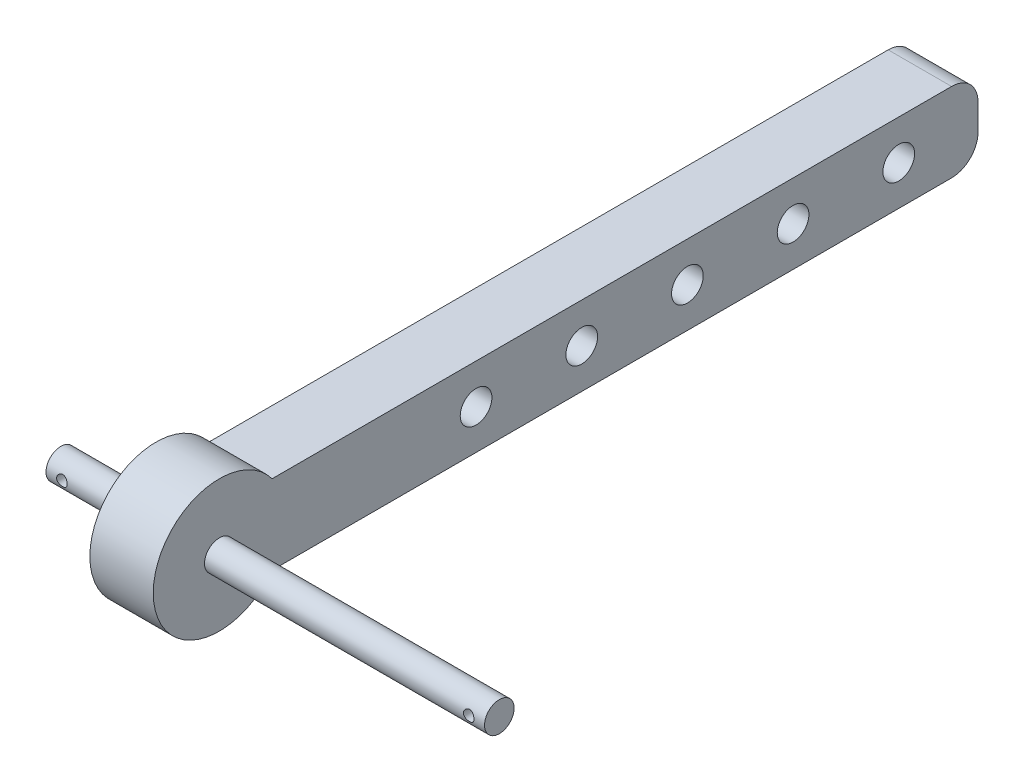
from build123d import *

# Parameters (mm, degrees)
SKETCH_1_W           = 150
SKETCH_1_H           = 15
EXTRUDE_1_DEPTH      = 12
FILLET_1_R           = 5
SKETCH_6_R           = 12.5
EXTRUDE_2_DEPTH      = 12
EXTRUDE_5_DEPTH      = 18
EXTRUDE_5_DEPTH_BACK = 65
SKETCH_15_R          = 2.8
CUT_EXTRUDE_9_REACH  = 166.697
SKETCH_16_R          = 1
CUT_EXTRUDE_10_REACH = 166.697
SKETCH_17_R          = 3


with BuildPart() as part:
    # 草图1 → 凸台-拉伸1 (new body)
    with BuildSketch(Plane(origin=(0, 0, 0), x_dir=(0, 0, -1), z_dir=(1, 0, 0))):
        with Locations((75, 7.5)):
            Rectangle(SKETCH_1_W, SKETCH_1_H)
    extrude(amount=EXTRUDE_1_DEPTH)

    # 圆角1
    fillet_1_edges = [part.edges().sort_by_distance(p)[0] for p in [
        (6, 15, 0),
        (6, 15, -150),
        (6, 0, -150),
        (6, 0, 0),
    ]]
    fillet(fillet_1_edges, radius=FILLET_1_R)

    # 草图6 → 凸台-拉伸2 (add)
    with BuildSketch(Plane(origin=(12, 0, 0), x_dir=(0, 0, -1), z_dir=(1, 0, 0))):
        with Locations((6.4, 7.5)):
            Circle(SKETCH_6_R)
    extrude(amount=-EXTRUDE_2_DEPTH)

    # 草图15 → 凸台-拉伸5 (add, two sides: drawn at the far end of the back side and taken through both)
    with BuildSketch(Plane.ZY.offset(-EXTRUDE_5_DEPTH_BACK)):
        with Locations((-6.4, 7.5)):
            Circle(SKETCH_15_R)
    extrude(amount=EXTRUDE_5_DEPTH + EXTRUDE_5_DEPTH_BACK)

    # 草图16 → 切除-拉伸9 (cut, up to next)
    with BuildSketch(Plane.XY, mode=Mode.PRIVATE) as cut_extrude_9_sk1:
        with Locations((-15, 7.5)):
            Circle(SKETCH_16_R)
    cut_extrude_9_tool1 = extrude(cut_extrude_9_sk1.sketch, amount=-CUT_EXTRUDE_9_REACH, mode=Mode.PRIVATE) & part.part
    # 草图16 → 切除-拉伸9 (cut, up to next)
    with BuildSketch(Plane.XY, mode=Mode.PRIVATE) as cut_extrude_9_sk2:
        with Locations((62, 7.5)):
            Circle(SKETCH_16_R)
    cut_extrude_9_tool2 = extrude(cut_extrude_9_sk2.sketch, amount=-CUT_EXTRUDE_9_REACH, mode=Mode.PRIVATE) & part.part
    add(cut_extrude_9_tool1.solids().sort_by_distance((-15, 7.5, 0))[0], mode=Mode.SUBTRACT)
    add(cut_extrude_9_tool2.solids().sort_by_distance((62, 7.5, 0))[0], mode=Mode.SUBTRACT)

    # 草图17 → 切除-拉伸10 (cut, up to next)
    with BuildSketch(Plane.ZY, mode=Mode.PRIVATE) as cut_extrude_10_sk1:
        with Locations((-135, 7.5)):
            Circle(SKETCH_17_R)
    cut_extrude_10_tool1 = extrude(cut_extrude_10_sk1.sketch, amount=-CUT_EXTRUDE_10_REACH, mode=Mode.PRIVATE) & part.part
    # 草图17 → 切除-拉伸10 (cut, up to next)
    with BuildSketch(Plane.ZY, mode=Mode.PRIVATE) as cut_extrude_10_sk2:
        with Locations((-115, 7.5)):
            Circle(SKETCH_17_R)
    cut_extrude_10_tool2 = extrude(cut_extrude_10_sk2.sketch, amount=-CUT_EXTRUDE_10_REACH, mode=Mode.PRIVATE) & part.part
    # 草图17 → 切除-拉伸10 (cut, up to next)
    with BuildSketch(Plane.ZY, mode=Mode.PRIVATE) as cut_extrude_10_sk3:
        with Locations((-95, 7.5)):
            Circle(SKETCH_17_R)
    cut_extrude_10_tool3 = extrude(cut_extrude_10_sk3.sketch, amount=-CUT_EXTRUDE_10_REACH, mode=Mode.PRIVATE) & part.part
    # 草图17 → 切除-拉伸10 (cut, up to next)
    with BuildSketch(Plane.ZY, mode=Mode.PRIVATE) as cut_extrude_10_sk4:
        with Locations((-75, 7.5)):
            Circle(SKETCH_17_R)
    cut_extrude_10_tool4 = extrude(cut_extrude_10_sk4.sketch, amount=-CUT_EXTRUDE_10_REACH, mode=Mode.PRIVATE) & part.part
    # 草图17 → 切除-拉伸10 (cut, up to next)
    with BuildSketch(Plane.ZY, mode=Mode.PRIVATE) as cut_extrude_10_sk5:
        with Locations((-55, 7.5)):
            Circle(SKETCH_17_R)
    cut_extrude_10_tool5 = extrude(cut_extrude_10_sk5.sketch, amount=-CUT_EXTRUDE_10_REACH, mode=Mode.PRIVATE) & part.part
    add(cut_extrude_10_tool1.solids().sort_by_distance((0, 7.5, -135))[0], mode=Mode.SUBTRACT)
    add(cut_extrude_10_tool2.solids().sort_by_distance((0, 7.5, -115))[0], mode=Mode.SUBTRACT)
    add(cut_extrude_10_tool3.solids().sort_by_distance((0, 7.5, -95))[0], mode=Mode.SUBTRACT)
    add(cut_extrude_10_tool4.solids().sort_by_distance((0, 7.5, -75))[0], mode=Mode.SUBTRACT)
    add(cut_extrude_10_tool5.solids().sort_by_distance((0, 7.5, -55))[0], mode=Mode.SUBTRACT)


solid = part.part
